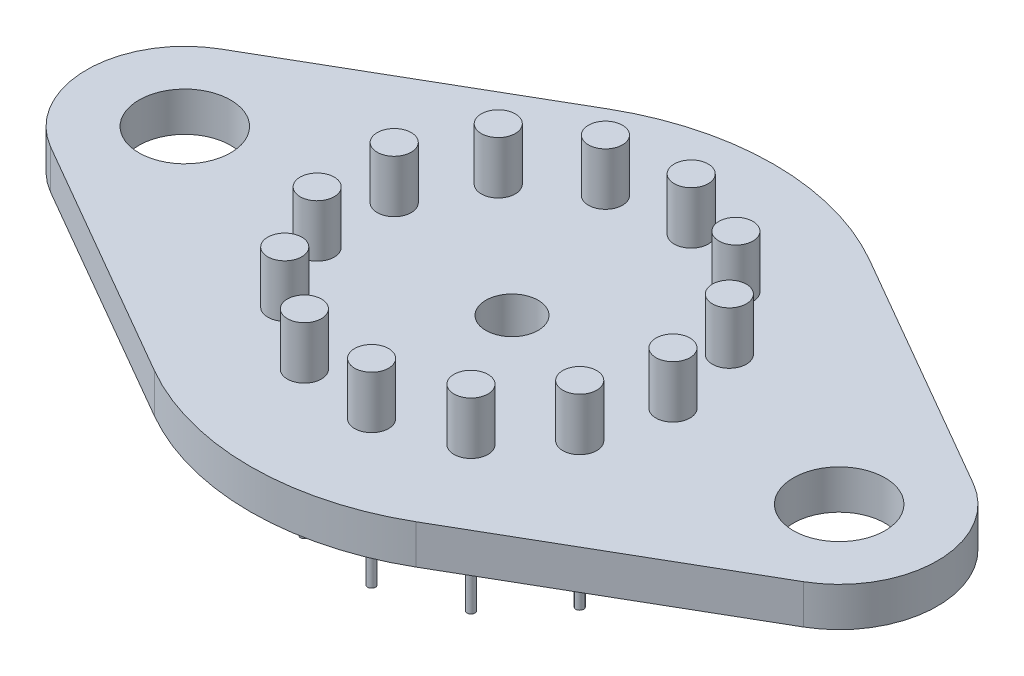
from build123d import *

# Parameters (mm, degrees)
BOSS_EXTRU_1_DEPTH      = 1.5
ESQUISSE2_R             = 1.75
ENL_V_MAT_EXTRU_1_DEPTH = 20.139292045
ESQUISSE3_R             = 0.65
BOSS_EXTRU_2_DEPTH      = 2
ESQUISSE4_R             = 0.15
BOSS_EXTRU_3_DEPTH      = 4
ESQUISSE6_R             = 1
ENL_V_MAT_EXTRU_2_DEPTH = 20.857303442


with BuildPart() as part:
    # Esquisse1 → Boss.-Extru.1 (new body)
    with BuildSketch(Plane(origin=(0, 0, 0), x_dir=(1, 0, 0), z_dir=(0, 1, 0))):
        with BuildLine():
            Line((-5, 8.660254038), (-14.375, 3.247595264))
            ThreePointArc((-14.375, 3.247595264), (-16.25, 0), (-14.375, -3.247595264))
            Line((-14.375, -3.247595264), (-5, -8.660254038))
            ThreePointArc((-5, -8.660254038), (0, -10), (5, -8.660254038))
            Line((5, -8.660254038), (14.375, -3.247595264))
            ThreePointArc((14.375, -3.247595264), (16.25, 0), (14.375, 3.247595264))
            Line((14.375, 3.247595264), (5, 8.660254038))
            ThreePointArc((5, 8.660254038), (0, 10), (-5, 8.660254038))
        make_face()
    extrude(amount=BOSS_EXTRU_1_DEPTH)

    # Esquisse2 → Enlèv. mat.-Extru.1 (cut, through all)
    with BuildSketch(Plane(origin=(0, 1.5, 0), x_dir=(1, 0, 0), z_dir=(0, 1, 0))):
        with Locations(Location((-12.5, 0, 0), (0, 0, 270))):
            Circle(ESQUISSE2_R)
        with Locations(Location((12.5, 0, 0), (0, 0, 270))):
            Circle(ESQUISSE2_R)
    extrude(amount=-ENL_V_MAT_EXTRU_1_DEPTH, mode=Mode.SUBTRACT)

    # Esquisse3 → Boss.-Extru.2 (add)
    with BuildSketch(Plane(origin=(0, 1.5, 0), x_dir=(1, 0, 0), z_dir=(0, 1, 0))):
        with Locations(Location((6.15, 0, 0), (0, 0, 270))):
            Circle(ESQUISSE3_R)
        with Locations(Location((5.445554558, -2.858047508, 0), (0, 0, 270))):
            Circle(ESQUISSE3_R)
        with Locations(Location((3.493598192, -5.061350775, 0), (0, 0, 270))):
            Circle(ESQUISSE3_R)
        with Locations(Location((0.741300584, -6.105159576, 0), (0, 0, 270))):
            Circle(ESQUISSE3_R)
        with Locations(Location((-2.180820055, -5.750349893, 0), (0, 0, 270))):
            Circle(ESQUISSE3_R)
        with Locations(Location((-4.603341101, -4.078204348, 0), (0, 0, 270))):
            Circle(ESQUISSE3_R)
        with Locations(Location((-5.971292177, -1.471791335, 0), (0, 0, 270))):
            Circle(ESQUISSE3_R)
        with Locations(Location((-5.971292177, 1.471791335, 0), (0, 0, 270))):
            Circle(ESQUISSE3_R)
        with Locations(Location((-4.603341101, 4.078204348, 0), (0, 0, 270))):
            Circle(ESQUISSE3_R)
        with Locations(Location((-2.180820055, 5.750349893, 0), (0, 0, 270))):
            Circle(ESQUISSE3_R)
        with Locations(Location((0.741300584, 6.105159576, 0), (0, 0, 270))):
            Circle(ESQUISSE3_R)
        with Locations(Location((3.493598192, 5.061350775, 0), (0, 0, 270))):
            Circle(ESQUISSE3_R)
        with Locations(Location((5.445554558, 2.858047508, 0), (0, 0, 270))):
            Circle(ESQUISSE3_R)
    extrude(amount=BOSS_EXTRU_2_DEPTH)

    # Esquisse4 → Boss.-Extru.3 (add)
    with BuildSketch(Plane.XZ):
        with Locations(Location((6.15, 0, 0), (0, 0, 90))):
            Circle(ESQUISSE4_R)
        with Locations(Location((5.445554558, -2.858047508, 0), (0, 0, 90))):
            Circle(ESQUISSE4_R)
        with Locations(Location((3.493598192, -5.061350775, 0), (0, 0, 90))):
            Circle(ESQUISSE4_R)
        with Locations(Location((0.741300584, -6.105159576, 0), (0, 0, 90))):
            Circle(ESQUISSE4_R)
        with Locations(Location((-2.180820055, -5.750349893, 0), (0, 0, 90))):
            Circle(ESQUISSE4_R)
        with Locations(Location((-4.603341101, -4.078204348, 0), (0, 0, 90))):
            Circle(ESQUISSE4_R)
        with Locations(Location((-5.971292177, -1.471791335, 0), (0, 0, 90))):
            Circle(ESQUISSE4_R)
        with Locations(Location((-5.971292177, 1.471791335, 0), (0, 0, 90))):
            Circle(ESQUISSE4_R)
        with Locations(Location((-4.603341101, 4.078204348, 0), (0, 0, 90))):
            Circle(ESQUISSE4_R)
        with Locations(Location((-2.180820055, 5.750349893, 0), (0, 0, 90))):
            Circle(ESQUISSE4_R)
        with Locations(Location((0.741300584, 6.105159576, 0), (0, 0, 90))):
            Circle(ESQUISSE4_R)
        with Locations(Location((3.493598192, 5.061350775, 0), (0, 0, 90))):
            Circle(ESQUISSE4_R)
        with Locations(Location((5.445554558, 2.858047508, 0), (0, 0, 90))):
            Circle(ESQUISSE4_R)
    extrude(amount=BOSS_EXTRU_3_DEPTH)

    # Esquisse6 → Enlèv. mat.-Extru.2 (cut, through all)
    with BuildSketch(Plane(origin=(0, 1.5, 0), x_dir=(1, 0, 0), z_dir=(0, 1, 0))):
        with Locations(Location((0, 0, 0), (0, 0, 270))):
            Circle(ESQUISSE6_R)
    extrude(amount=-ENL_V_MAT_EXTRU_2_DEPTH, mode=Mode.SUBTRACT)


solid = part.part
